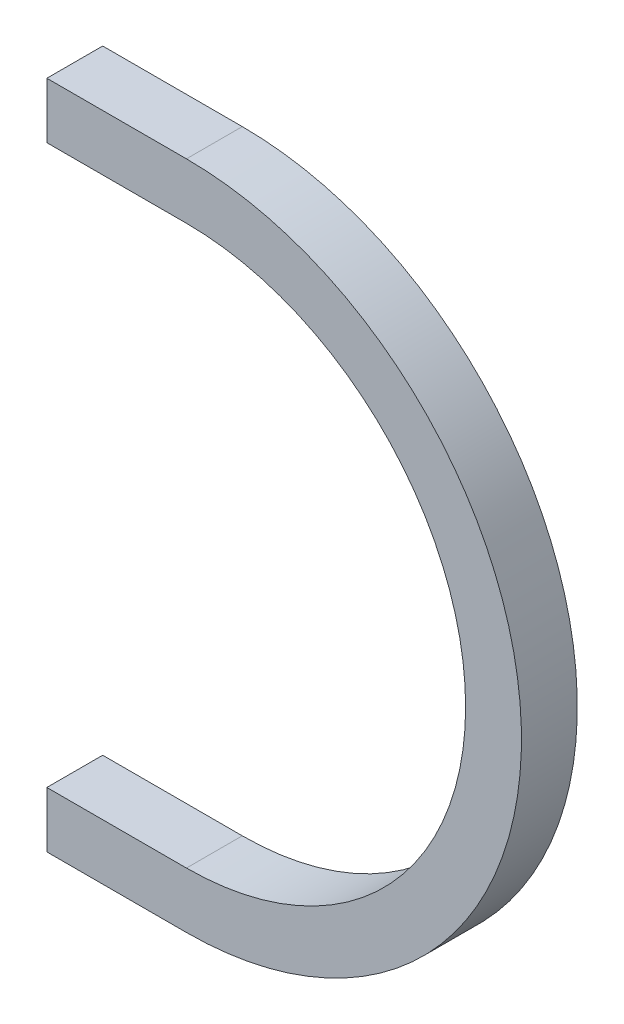
from build123d import *

# Parameters (mm, degrees)
BOSS_EXTRUDE1_DEPTH = 200


with BuildPart() as part:
    # Sketch2 → Boss-Extrude1 (new body)
    with BuildSketch(Plane.XY):
        with BuildLine():
            Line((0, 0), (0, -200))
            Line((0, -200), (500, -200))
            ThreePointArc((500, -200), (1500, -1200), (500, -2200))
            Line((500, -2200), (0, -2200))
            Line((0, -2200), (0, -2400))
            Line((0, -2400), (500, -2400))
            ThreePointArc((500, -2400), (1700, -1200), (500, 0))
            Line((500, 0), (0, 0))
        make_face()
    extrude(amount=BOSS_EXTRUDE1_DEPTH)


solid = part.part
